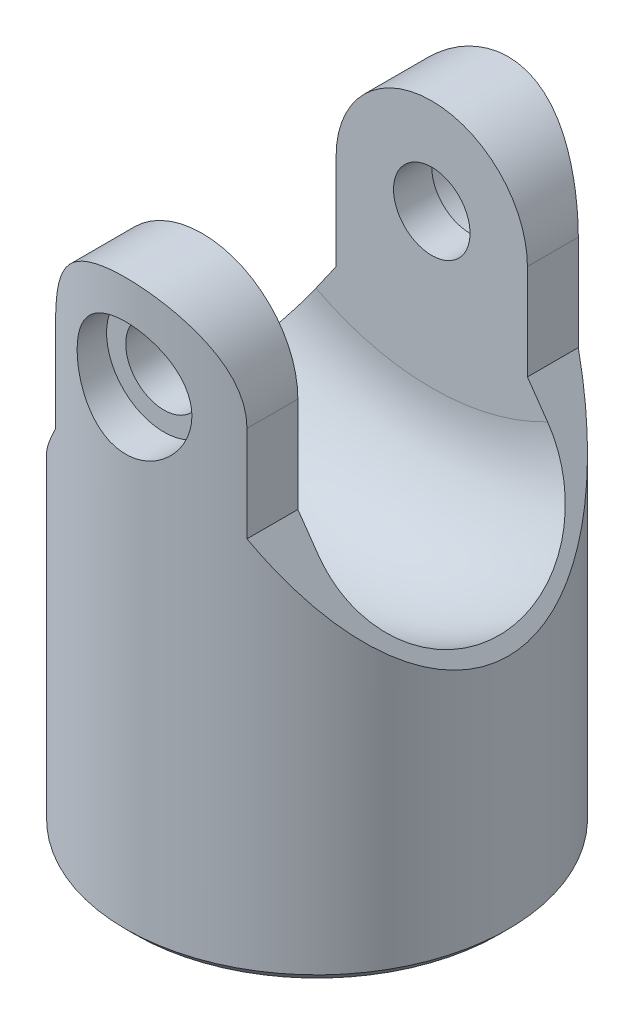
from build123d import *

# Parameters (mm, degrees)
CROQUIS1_R                 = 20
SALIENTE_EXTRUIR1_DEPTH    = 110
CORTAR_EXTRUIR1_DEPTH      = 110
CORTAR_EXTRUIR1_DEPTH_BACK = 110
CORTAR_EXTRUIR2_DEPTH      = 110
CORTAR_EXTRUIR2_DEPTH_BACK = 110
CROQUIS4_R                 = 4
CROQUIS5_R                 = 6
CORTAR_EXTRUIR4_DEPTH      = 4
CORTAR_EXTRUIR5_DEPTH      = 30
CORTAR_EXTRUIR5_DEPTH_BACK = 40
CROQUIS10_W                = 40
CROQUIS10_H                = 50
SALIENTE_EXTRUIR2_START    = 20
CROQUIS11_R                = 14
SALIENTE_EXTRUIR2_DEPTH    = 20
CROQUIS12_R                = 10
CORTAR_EXTRUIR6_DEPTH      = 18
CROQUIS14_W                = 6
CROQUIS14_H                = 2
CORTAR_EXTRUIR7_DEPTH      = 18
CROQUIS16_R                = 3
CORTAR_EXTRUIR8_DEPTH      = 9
CHAFL_N1_SIZE              = 1


with BuildPart() as part:
    # Croquis1 → Saliente-Extruir1 (new body)
    with BuildSketch(Plane(origin=(0, 0, 0), x_dir=(1, 0, 0), z_dir=(0, 1, 0))):
        with Locations(Location((0, 0, 0), (0, 0, 270))):
            Circle(CROQUIS1_R)
    extrude(amount=SALIENTE_EXTRUIR1_DEPTH)

    # Croquis2 → Cortar-Extruir1 (cut, two sides: drawn at the far end of the back side and taken through both)
    with BuildSketch(Plane.XY.offset(-CORTAR_EXTRUIR1_DEPTH_BACK)):
        with BuildLine():
            Line((-10, 90), (-10, 100))
            ThreePointArc((-10, 100), (-7.071067812, 107.071067812), (0, 110))
            Line((0, 110), (-20, 110))
            Line((-20, 110), (-20, 75.718519933))
            Line((-20, 75.718519933), (-10, 90))
        make_face()
        with BuildLine():
            Line((20, 110), (0, 110))
            ThreePointArc((0, 110), (7.071067812, 107.071067812), (10, 100))
            Line((10, 100), (10, 90))
            Line((10, 90), (20, 75.718519933))
            Line((20, 75.718519933), (20, 110))
        make_face()
    extrude(amount=CORTAR_EXTRUIR1_DEPTH + CORTAR_EXTRUIR1_DEPTH_BACK, mode=Mode.SUBTRACT)

    # Croquis4 → Cortar-Extruir2 (cut, two sides: drawn at the far end of the back side and taken through both)
    with BuildSketch(Plane.XY.offset(-CORTAR_EXTRUIR2_DEPTH_BACK)):
        with Locations(Location((0, 100, 0), (0, 0, 180))):
            Circle(CROQUIS4_R)
    extrude(amount=CORTAR_EXTRUIR2_DEPTH + CORTAR_EXTRUIR2_DEPTH_BACK, mode=Mode.SUBTRACT)

    # Croquis3 → Cortar-Revolución1 (revolve, cut)
    with BuildSketch(Plane(origin=(0, 0, 0), x_dir=(0, 0, -1), z_dir=(1, 0, 0))):
        with BuildLine():
            Line((-12, 110), (12, 110))
            Line((12, 110), (12, 84))
            ThreePointArc((12, 84), (0, 72), (-12, 84))
            Line((-12, 84), (-12, 110))
        make_face()
    revolve(axis=Axis((0, 110, 12), (0, 0, -1)), mode=Mode.SUBTRACT)

    # Croquis5 → Cortar-Extruir4 (cut)
    with BuildSketch(Plane.XY.offset(20)):
        with Locations((0, 100)):
            Circle(CROQUIS5_R)
    cortar_extruir4 = extrude(amount=-CORTAR_EXTRUIR4_DEPTH, mode=Mode.SUBTRACT)

    # Simetría1: Cortar-Extruir4 across plane
    add(cortar_extruir4.mirror(Plane.XY), mode=Mode.SUBTRACT)

    # Croquis6 → Cortar-Revolución2 (revolve, cut)
    with BuildSketch(Plane.XY, mode=Mode.PRIVATE) as cortar_revoluci_n2_sk:
        Polygon((-9, 0), (0, 0), (0, 70), (-14, 70), (-14, 30), (-9, 30), align=None)
    revolve(cortar_revoluci_n2_sk.sketch.rotate(Axis((0, 70, 0), (0, -1, 0)), 270), axis=Axis((0, 70, 0), (0, -1, 0)), mode=Mode.SUBTRACT)

    # Croquis10 → Cortar-Extruir5 (cut, two sides: drawn at the far end of the back side and taken through both)
    with BuildSketch(Plane.XY.offset(-CORTAR_EXTRUIR5_DEPTH_BACK)):
        with Locations((0, 25)):
            Rectangle(CROQUIS10_W, CROQUIS10_H)
    extrude(amount=CORTAR_EXTRUIR5_DEPTH + CORTAR_EXTRUIR5_DEPTH_BACK, mode=Mode.SUBTRACT)

    # Croquis11 → Saliente-Extruir2 (add)
    with BuildSketch(Plane.XZ.offset(-70).offset(SALIENTE_EXTRUIR2_START)):
        Circle(CROQUIS11_R)
    extrude(amount=-SALIENTE_EXTRUIR2_DEPTH)

    # Croquis12 → Cortar-Extruir6 (cut)
    with BuildSketch(Plane.XZ.offset(-50)):
        with Locations(Location((0, 0, 0), (0, 0, 270))):
            Circle(CROQUIS12_R)
    extrude(amount=-CORTAR_EXTRUIR6_DEPTH, mode=Mode.SUBTRACT)

    # Croquis14 → Cortar-Extruir7 (cut)
    with BuildSketch(Plane.XZ.offset(-50)):
        with Locations((0, -10)):
            Rectangle(CROQUIS14_W, CROQUIS14_H)
    extrude(amount=-CORTAR_EXTRUIR7_DEPTH, mode=Mode.SUBTRACT)

    # Croquis16 → Cortar-Extruir8 (cut)
    with BuildSketch(Plane(origin=(0, 0, -20), x_dir=(-1, 0, 0), z_dir=(0, 0, -1))):
        with Locations((0, 59)):
            Circle(CROQUIS16_R)
    extrude(amount=-CORTAR_EXTRUIR8_DEPTH, mode=Mode.SUBTRACT)

    # Chaflán1
    chafl_n1_edges = [part.edges().sort_by_distance(p)[0] for p in [
        (0, 50, -20),
    ]]
    chamfer(chafl_n1_edges, length=CHAFL_N1_SIZE)


solid = part.part
